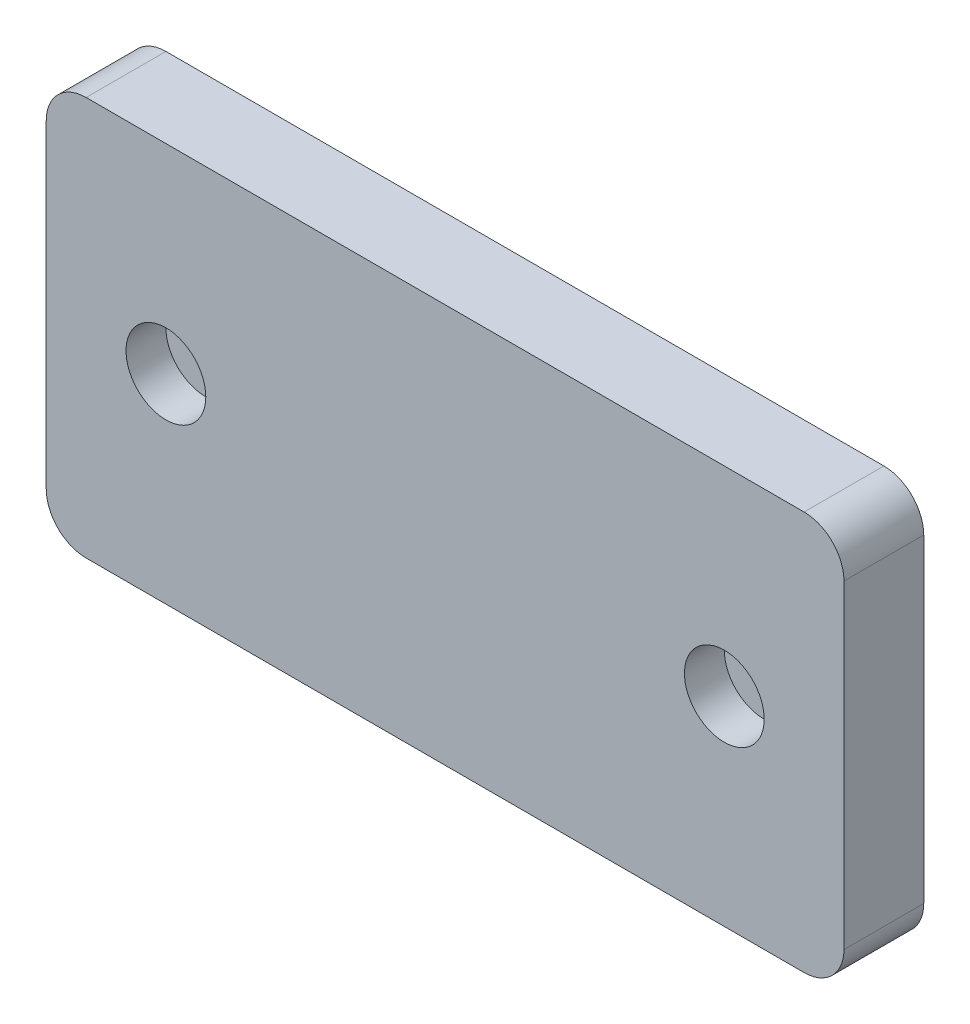
from build123d import *

# Parameters (mm, degrees)
SKETCH1_W           = 10000
SKETCH1_H           = 5000
BOSS_EXTRUDE1_DEPTH = 1000
FILLET1_R           = 500
FILLET2_R           = 500
SKETCH2_R           = 500
CUT_EXTRUDE1_DEPTH  = 500


with BuildPart() as part:
    # Sketch1 → Boss-Extrude1 (new body)
    with BuildSketch(Plane.XY):
        Rectangle(SKETCH1_W, SKETCH1_H)
    extrude(amount=BOSS_EXTRUDE1_DEPTH)

    # Fillet1
    fillet1_edges = [part.edges().sort_by_distance(p)[0] for p in [
        (-5000, 2500, 500),
    ]]
    fillet(fillet1_edges, radius=FILLET1_R)

    # Fillet2
    fillet2_edges = [part.edges().sort_by_distance(p)[0] for p in [
        (5000, -2500, 500),
        (-5000, -2500, 500),
        (5000, 2500, 500),
    ]]
    fillet(fillet2_edges, radius=FILLET2_R)

    # Sketch2 → Cut-Extrude1 (cut)
    with BuildSketch(Plane.XY.offset(1000)):
        with Locations((-3500, 0)):
            Circle(SKETCH2_R)
        with Locations((3500, 0)):
            Circle(SKETCH2_R)
    extrude(amount=-CUT_EXTRUDE1_DEPTH, mode=Mode.SUBTRACT)


solid = part.part
